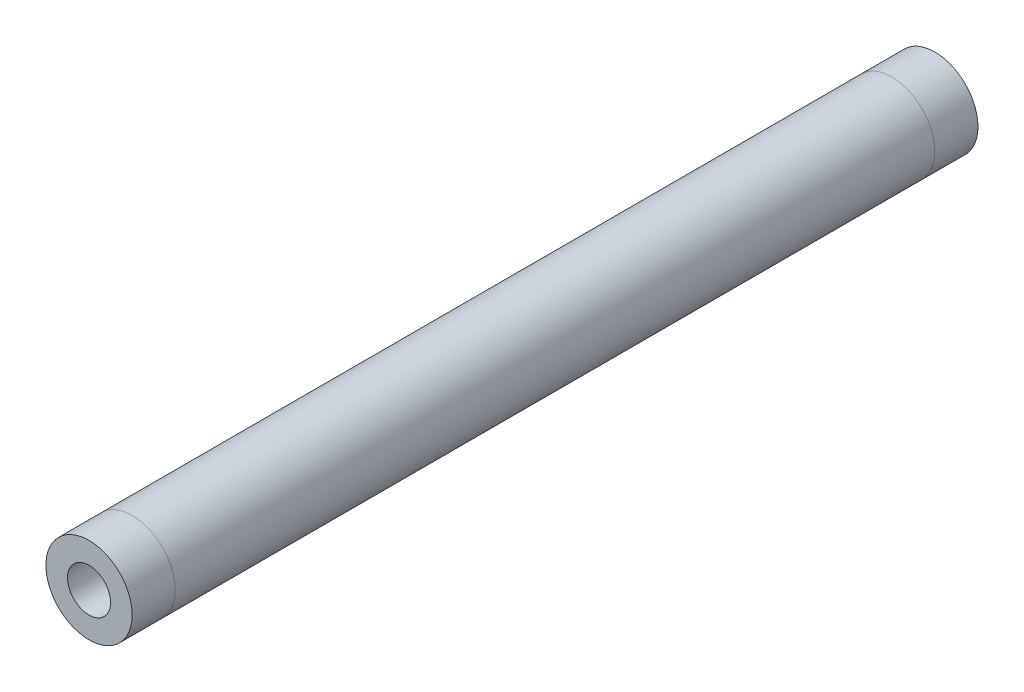
from build123d import *

# Parameters (mm, degrees)
THREADED_START            = -21.9075
SKETCH2_R                 = 6.35
SKETCH2_R_2               = 4.7625
SKETCH2_R_3               = 3.175
THREADED_INSERT_1_1_DEPTH = 6.35
THREADED_START_2          = -28.2575
SKETCH2_5_R               = 4.7625
SKETCH2_5_R_2             = 3.175
THREADED_INSERT_1_2_DEPTH = 6.35
BOSS_EXTRUDE4_START       = -146.501053
SKETCH2_7_R               = 6.35
SKETCH2_7_R_2             = 4.7625
SKETCH2_7_R_3             = 3.175
BOSS_EXTRUDE4_DEPTH       = 6.35
BOSS_EXTRUDE5_START       = -133.801053
SKETCH2_8_R               = 4.7625
SKETCH2_8_R_2             = 3.175
BOSS_EXTRUDE5_DEPTH       = 6.35
BOSS_EXTRUDE6_START       = -28.2575
SKETCH2_9_R               = 6.35
SKETCH2_9_R_2             = 4.7625
BOSS_EXTRUDE6_DEPTH       = 111.8935532


with BuildPart() as part:
    # Sketch2 → Threaded Insert 1-1 (new body)
    # profile 1 of 2: a face of its own
    with BuildSketch(Plane.XY.offset(THREADED_START)):
        Circle(SKETCH2_R)
        Circle(SKETCH2_R_2, mode=Mode.SUBTRACT)
    # profile 2 of 2: a face of its own
    with BuildSketch(Plane.XY.offset(THREADED_START)):
        Circle(SKETCH2_R_2)
        Circle(SKETCH2_R_3, mode=Mode.SUBTRACT)
    extrude(amount=-THREADED_INSERT_1_1_DEPTH)

    # Sketch2<5> → Threaded Insert 1-2 (add)
    with BuildSketch(Plane.XY.offset(THREADED_START_2)):
        Circle(SKETCH2_5_R)
        Circle(SKETCH2_5_R_2, mode=Mode.SUBTRACT)
    extrude(amount=-THREADED_INSERT_1_2_DEPTH)


with BuildPart() as body_2:
    # Sketch2<7> → Boss-Extrude4 (new body)
    # profile 1 of 2: a face of its own
    with BuildSketch(Plane.XY.offset(BOSS_EXTRUDE4_START)):
        Circle(SKETCH2_7_R)
        Circle(SKETCH2_7_R_2, mode=Mode.SUBTRACT)
    # profile 2 of 2: a face of its own
    with BuildSketch(Plane.XY.offset(BOSS_EXTRUDE4_START)):
        Circle(SKETCH2_7_R_2)
        Circle(SKETCH2_7_R_3, mode=Mode.SUBTRACT)
    extrude(amount=BOSS_EXTRUDE4_DEPTH)

    # Sketch2<8> → Boss-Extrude5 (add)
    with BuildSketch(Plane.XY.offset(BOSS_EXTRUDE5_START)):
        Circle(SKETCH2_8_R)
        Circle(SKETCH2_8_R_2, mode=Mode.SUBTRACT)
    extrude(amount=-BOSS_EXTRUDE5_DEPTH)


with BuildPart() as body_3:
    # Sketch2<9> → Boss-Extrude6 (new body)
    with BuildSketch(Plane.XY.offset(BOSS_EXTRUDE6_START)):
        Circle(SKETCH2_9_R)
        Circle(SKETCH2_9_R_2, mode=Mode.SUBTRACT)
    extrude(amount=-BOSS_EXTRUDE6_DEPTH)


solid = Compound([part.part, body_2.part, body_3.part])
